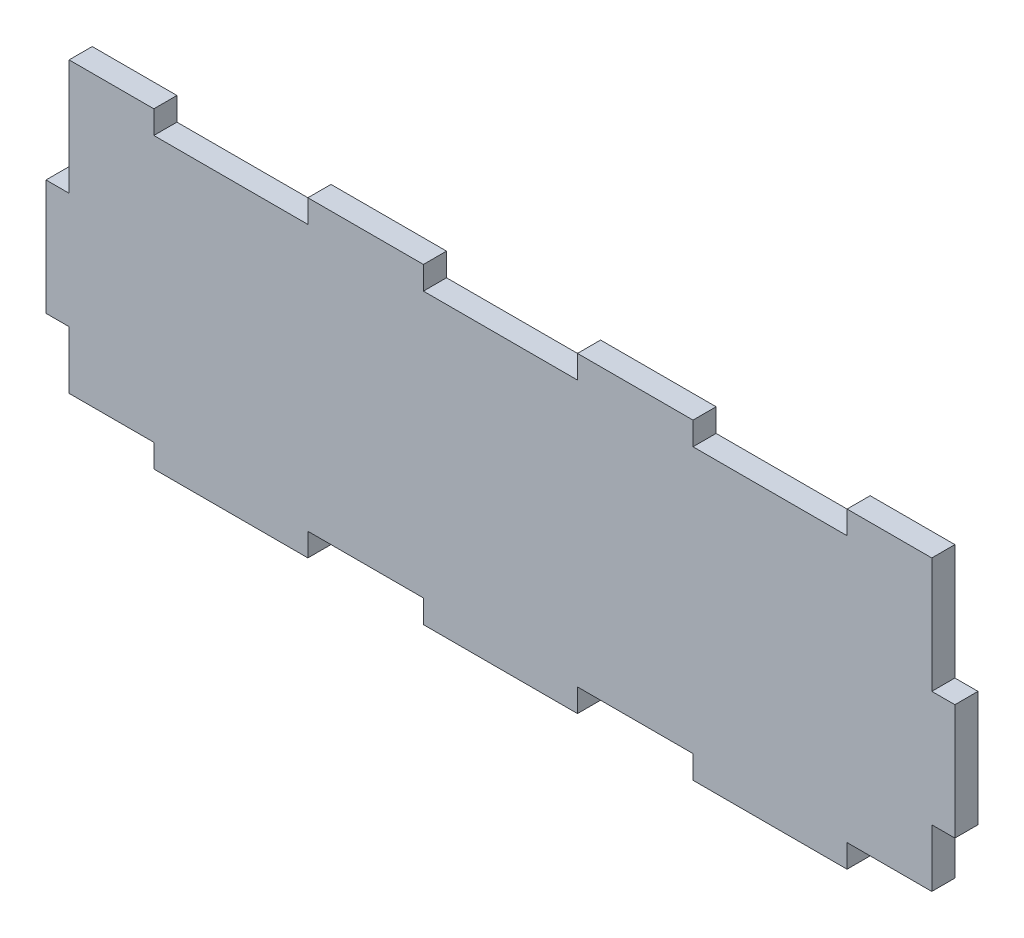
from build123d import *

# Parameters (mm, degrees)
SKETCH2_W           = 112
SKETCH2_H           = 60
SKETCH2_W_2         = 20
SKETCH2_H_2         = 3
SKETCH2_W_3         = 3
SKETCH2_H_3         = 15
BOSS_EXTRUDE1_DEPTH = 3
SKETCH4_W           = 20
SKETCH4_H           = 3
CUT_EXTRUDE2_DEPTH  = 10


with BuildPart() as part:
    # Sketch2 → Boss-Extrude1 (new body)
    with BuildSketch(Plane.XY):
        Rectangle(SKETCH2_W, SKETCH2_H)
        with Locations((-35, -31.5)):
            Rectangle(SKETCH2_W_2, SKETCH2_H_2)
        with Locations((0, -31.5)):
            Rectangle(SKETCH2_W_2, SKETCH2_H_2)
        with Locations((35, -31.5)):
            Rectangle(SKETCH2_W_2, SKETCH2_H_2)
        with Locations((57.5, -15)):
            Rectangle(SKETCH2_W_3, SKETCH2_H_3)
        with Locations((-57.5, -15)):
            Rectangle(SKETCH2_W_3, SKETCH2_H_3)
        with Locations((-57.5, 15)):
            Rectangle(SKETCH2_W_3, SKETCH2_H_3)
        with Locations((57.5, 15)):
            Rectangle(SKETCH2_W_3, SKETCH2_H_3)
    extrude(amount=BOSS_EXTRUDE1_DEPTH)

    # Sketch4 → Cut-Extrude2 (cut)
    with BuildSketch(Plane.XY.offset(3)):
        with Locations((-35, 6)):
            Rectangle(SKETCH4_W, SKETCH4_H)
        with Locations((0, 6)):
            Rectangle(SKETCH4_W, SKETCH4_H)
        with Locations((35, 6)):
            Rectangle(SKETCH4_W, SKETCH4_H)
        Polygon((-59, 22.5), (-59, 7.5), (-56, 7.5), (-45, 7.5), (-25, 7.5), (-10, 7.5), (10, 7.5), (25, 7.5), (45, 7.5), (56, 7.5), (59, 7.5), (59, 22.5), (56, 22.5), (56, 30), (-56, 30), (-56, 22.5), align=None)
    extrude(amount=-CUT_EXTRUDE2_DEPTH, mode=Mode.SUBTRACT)


solid = part.part
